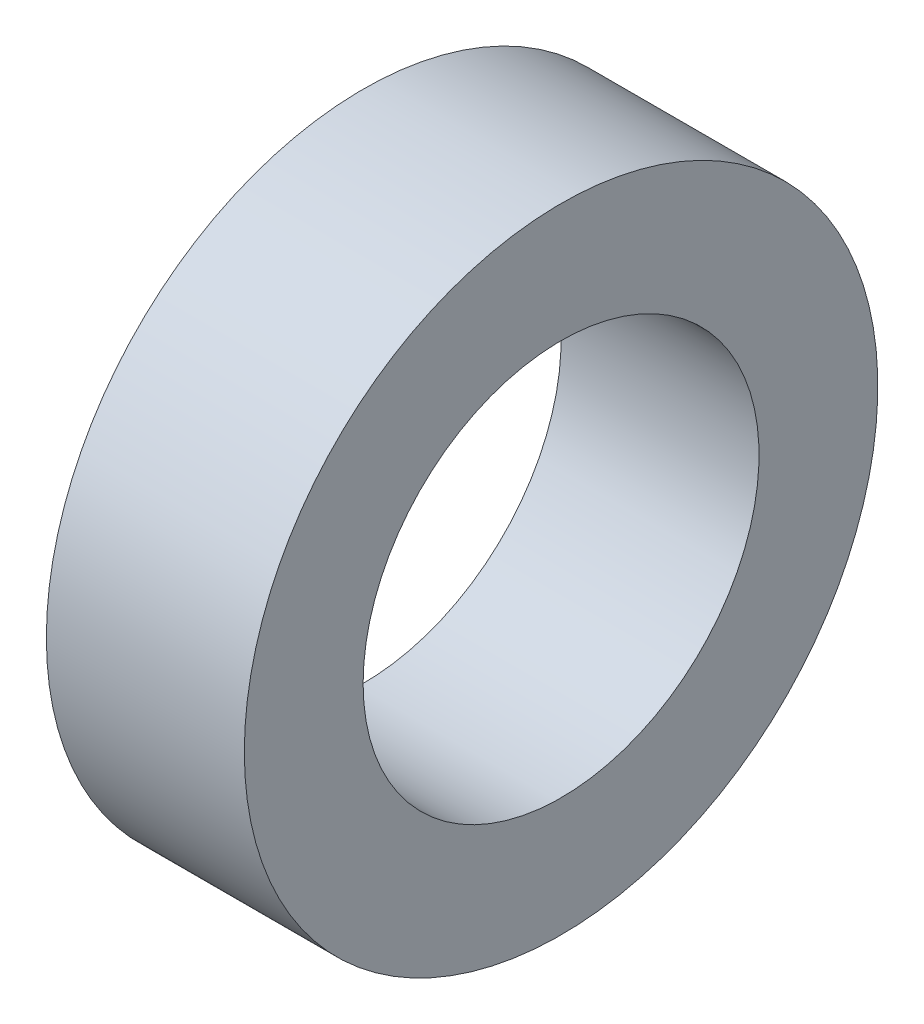
from build123d import *

# Parameters (mm, degrees)
SKETCH1_W = 2.5
SKETCH1_H = 1.5


with BuildPart() as part:
    # Sketch1 → Revolve1 (revolve)
    with BuildSketch(Plane.XY, mode=Mode.PRIVATE) as revolve1_sk:
        with Locations((1.25, 3.25)):
            Rectangle(SKETCH1_W, SKETCH1_H)
    revolve(revolve1_sk.sketch.rotate(Axis((0, 0, 0), (1, 0, 0)), 90), axis=Axis((0, 0, 0), (1, 0, 0)))


solid = part.part
